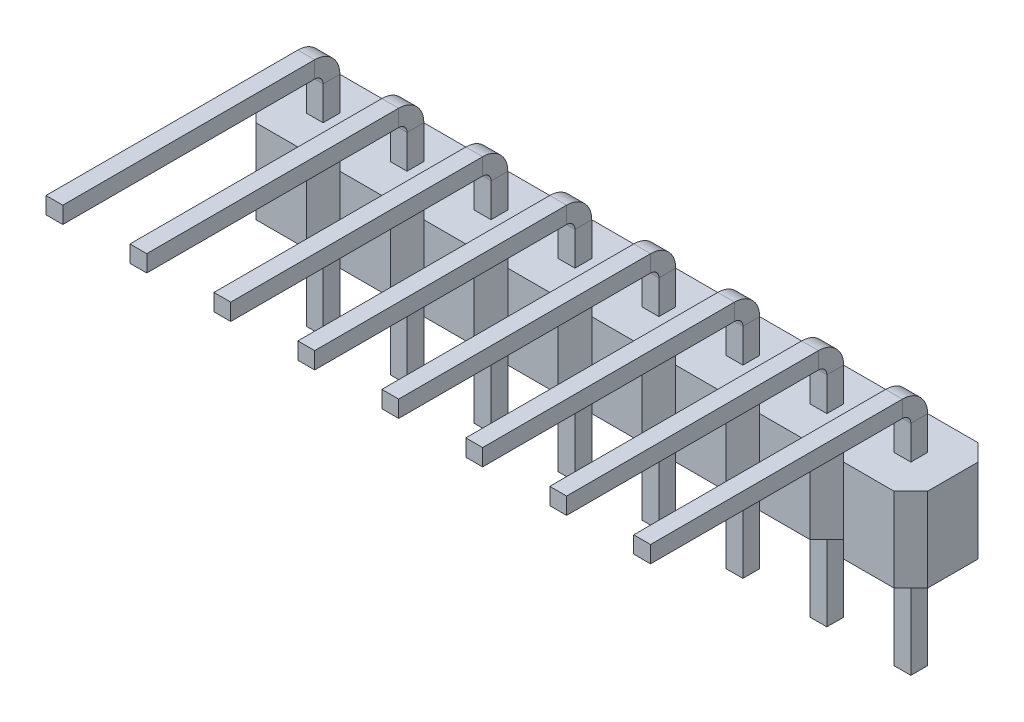
from build123d import *

# Parameters (mm, degrees)
BOSS_EXTRUDE1_DEPTH = 2.5
SKETCH2_W           = 0.5
SKETCH2_H           = 0.5
BOSS_EXTRUDE3_DEPTH = 5.5
SKETCH2_3_W         = 0.5
SKETCH2_3_H         = 0.5


with BuildPart() as part:
    # Sketch1 → Boss-Extrude1 (new body)
    with BuildSketch(Plane(origin=(0, 0, 0), x_dir=(1, 0, 0), z_dir=(0, 1, 0))):
        Polygon((-1.25, 0.75), (-0.75, 1.25), (0.75, 1.25), (1.25, 0.75), (1.75, 1.25), (3.25, 1.25), (3.75, 0.75), (4.25, 1.25), (5.75, 1.25), (6.25, 0.75), (6.75, 1.25), (8.25, 1.25), (8.75, 0.75), (9.25, 1.25), (10.75, 1.25), (11.25, 0.75), (11.75, 1.25), (13.25, 1.25), (13.75, 0.75), (14.25, 1.25), (15.75, 1.25), (16.25, 0.75), (16.75, 1.25), (18.25, 1.25), (18.75, 0.75), (18.75, -0.75), (18.25, -1.25), (16.75, -1.25), (16.25, -0.75), (15.75, -1.25), (14.25, -1.25), (13.75, -0.75), (13.25, -1.25), (11.75, -1.25), (11.25, -0.75), (10.75, -1.25), (9.25, -1.25), (8.75, -0.75), (8.25, -1.25), (6.75, -1.25), (6.25, -0.75), (5.75, -1.25), (4.25, -1.25), (3.75, -0.75), (3.25, -1.25), (1.75, -1.25), (1.25, -0.75), (0.75, -1.25), (-0.75, -1.25), (-1.25, -0.75), align=None)
    extrude(amount=BOSS_EXTRUDE1_DEPTH)

    # Sketch2 → Boss-Extrude3 (add)
    with BuildSketch(Plane(origin=(0, 2.5, 0), x_dir=(1, 0, 0), z_dir=(0, 1, 0))):
        with Locations((2.5, 0)):
            Rectangle(SKETCH2_W, SKETCH2_H)
        Rectangle(SKETCH2_W, SKETCH2_H)
        with Locations((5, 0)):
            Rectangle(SKETCH2_W, SKETCH2_H)
        with Locations((7.5, 0)):
            Rectangle(SKETCH2_W, SKETCH2_H)
        with Locations((10, 0)):
            Rectangle(SKETCH2_W, SKETCH2_H)
        with Locations((12.5, 0)):
            Rectangle(SKETCH2_W, SKETCH2_H)
        with Locations((15, 0)):
            Rectangle(SKETCH2_W, SKETCH2_H)
        with Locations((17.5, 0)):
            Rectangle(SKETCH2_W, SKETCH2_H)
    extrude(amount=-BOSS_EXTRUDE3_DEPTH)

    # Sweep1: sweep along a path in Sketch3
    with BuildLine(Plane(origin=(0, 0, 0), x_dir=(0, 0, -1), z_dir=(1, 0, 0))) as sweep1_path:
        Line((0, 2.5), (0, 3.5))
        ThreePointArc((0, 3.5), (-0.146446609, 3.853553391), (-0.5, 4))
        Line((-0.5, 4), (-8, 4))
    # Sketch2<3> → Sweep1 (sweep)
    with BuildSketch(Plane(origin=(0, 2.5, 0), x_dir=(1, 0, 0), z_dir=(0, 1, 0))):
        with Locations((2.5, 0)):
            Rectangle(SKETCH2_3_W, SKETCH2_3_H)
        Rectangle(SKETCH2_3_W, SKETCH2_3_H)
        with Locations((5, 0)):
            Rectangle(SKETCH2_3_W, SKETCH2_3_H)
        with Locations((7.5, 0)):
            Rectangle(SKETCH2_3_W, SKETCH2_3_H)
        with Locations((10, 0)):
            Rectangle(SKETCH2_3_W, SKETCH2_3_H)
        with Locations((12.5, 0)):
            Rectangle(SKETCH2_3_W, SKETCH2_3_H)
        with Locations((15, 0)):
            Rectangle(SKETCH2_3_W, SKETCH2_3_H)
        with Locations((17.5, 0)):
            Rectangle(SKETCH2_3_W, SKETCH2_3_H)
    sweep(path=sweep1_path.line)


solid = part.part
